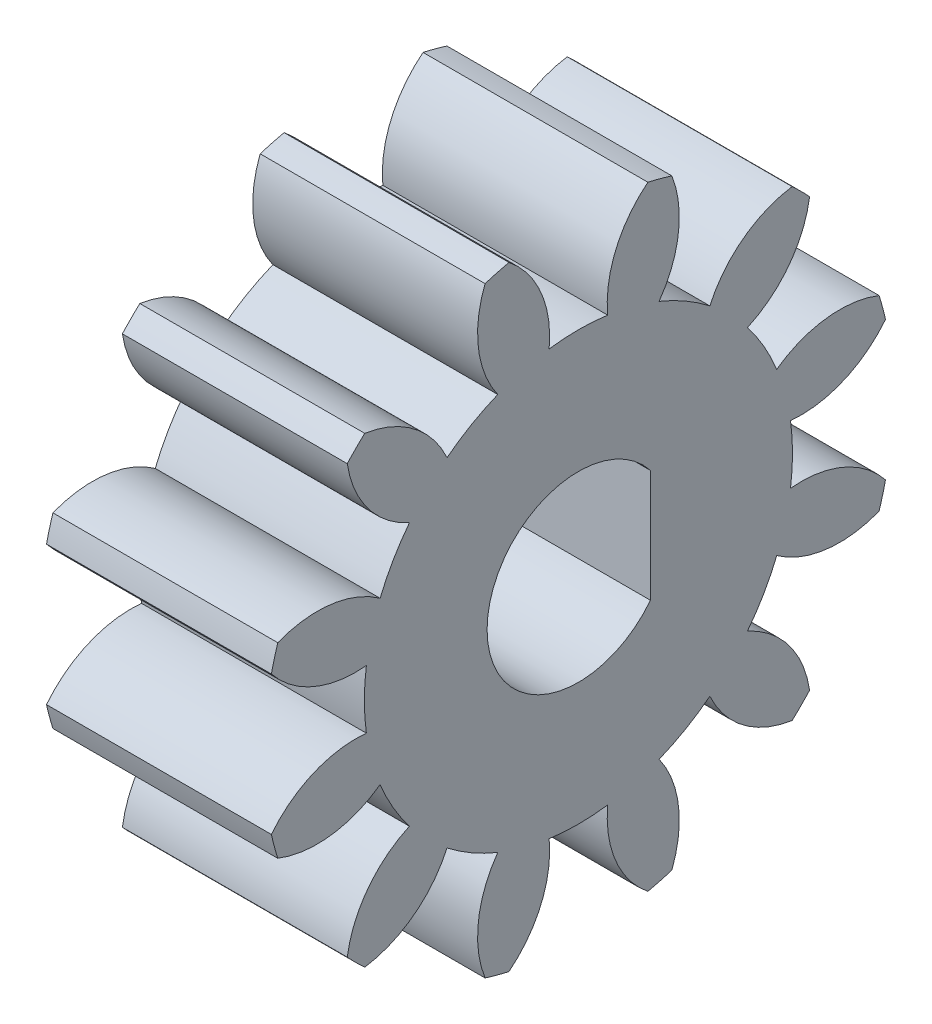
from build123d import *

# Parameters (mm, degrees)
BASPROSKE_W        = 6.35
BASPROSKE_H        = 8.89
TOOTHCUT_DEPTH     = 15.084981363
TEETHCUTS_COUNT    = 12
TEETHCUTS_ANGLE    = 330
BORSKE_R           = 1.5875
BORE_DEPTH         = 50.8000508
SKETCH1_R          = 1.5875
CUT_EXTRUDE1_DEPTH = 14.80904612


with BuildPart() as part:
    # BasProSke → Base-Revolve (revolve)
    with BuildSketch(Plane(origin=(0, 0, 0), x_dir=(1, 0, 0), z_dir=(0, 1, 0)), mode=Mode.PRIVATE) as base_revolve_sk:
        with Locations((3.175, 4.445)):
            Rectangle(BASPROSKE_W, BASPROSKE_H)
    revolve(base_revolve_sk.sketch.rotate(Axis((-10, 0, 0), (1, 0, 0)), 180), axis=Axis((-10, 0, 0), (1, 0, 0)))

    # TooCutSke → ToothCut (cut, through all)
    with BuildSketch(Plane(origin=(0, 0, 0), x_dir=(0, 0, -1), z_dir=(1, 0, 0))):
        with BuildLine():
            ThreePointArc((0.827157768, 5.988343099), (0, 6.0452), (-0.827157768, 5.988343099))
            ThreePointArc((-0.827157768, 5.988343099), (-1.059713146, 7.488912311), (-1.987413555, 8.691061185))
            ThreePointArc((-1.987413555, 8.691061185), (0, 8.9154), (1.987413555, 8.691061185))
            ThreePointArc((1.987413555, 8.691061185), (1.059713146, 7.488912311), (0.827157768, 5.988343099))
        make_face()
    toothcut = extrude(amount=TOOTHCUT_DEPTH, mode=Mode.SUBTRACT)

    # TeethCuts: ToothCut ×12 about axis
    teethcuts_axis = Axis((-10, 0, 0), (1, 0, 0))
    for i in range(1, TEETHCUTS_COUNT):
        add(toothcut.rotate(teethcuts_axis, i * TEETHCUTS_ANGLE / (TEETHCUTS_COUNT - 1)), mode=Mode.SUBTRACT)

    # BorSke → Bore (cut, symmetric)
    with BuildSketch(Plane(origin=(0, 0, 0), x_dir=(0, 0, -1), z_dir=(1, 0, 0))):
        with Locations(Location((0, 0, 0), (0, 0, 180))):
            Circle(BORSKE_R)
    extrude(amount=BORE_DEPTH, both=True, mode=Mode.SUBTRACT)

    # Sketch1 → Cut-Extrude1 (cut, through all)
    with BuildSketch(Plane(origin=(6.35, 0, 0), x_dir=(0, 0, -1), z_dir=(1, 0, 0))):
        with BuildLine():
            Line((2.033379293, -1.5875), (2.033379293, 1.5875))
            ThreePointArc((2.033379293, 1.5875), (-2.5796875, 0), (2.033379293, -1.5875))
        make_face()
        Circle(SKETCH1_R, mode=Mode.SUBTRACT)
    extrude(amount=-CUT_EXTRUDE1_DEPTH, mode=Mode.SUBTRACT)


solid = part.part
